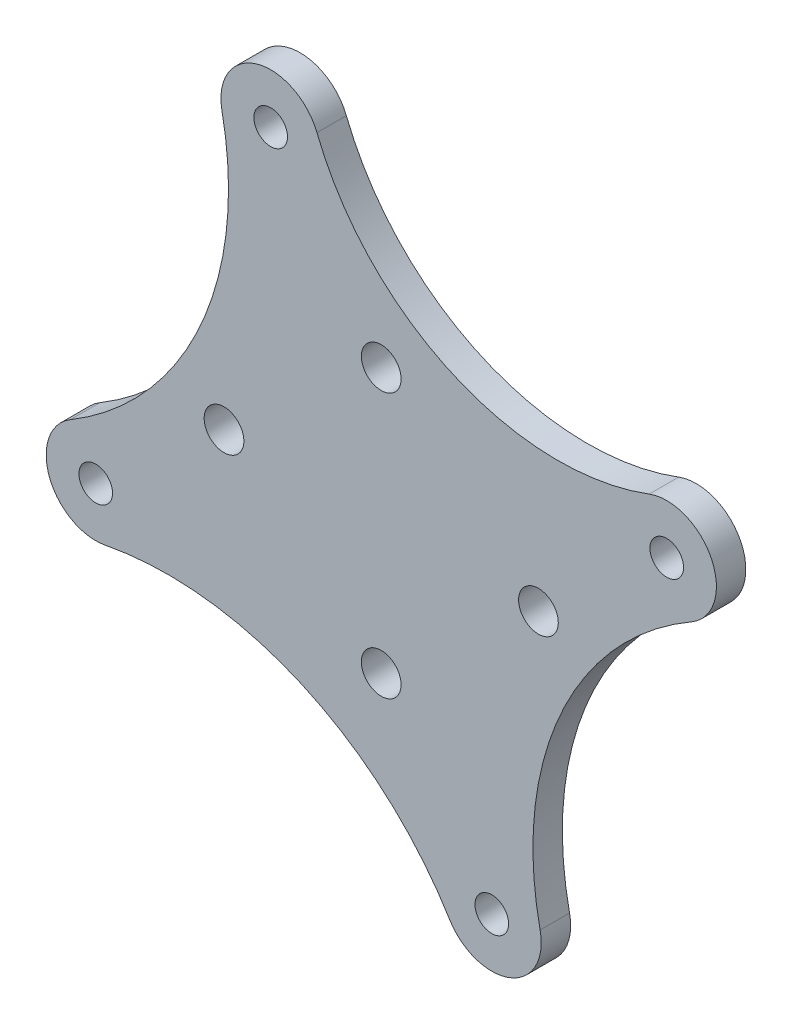
from build123d import *

# Parameters (mm, degrees)
SKETCH1_R           = 1.2
SKETCH1_R_2         = 1.016
BOSS_EXTRUDE1_DEPTH = 1.778


with BuildPart() as part:
    # Sketch1 → Boss-Extrude1 (new body)
    with BuildSketch(Plane.XY):
        with BuildLine():
            ThreePointArc((-18.786436302, -4.117817235), (-20.050708925, -7.759998805), (-16.680479475, -9.632276912))
            ThreePointArc((-16.680479475, -9.632276912), (-4.834628254, -10.963744593), (4.131590393, -18.818928901))
            ThreePointArc((4.131590393, -18.818928901), (7.793176957, -20.037700838), (9.603735314, -16.629695609))
            ThreePointArc((9.603735314, -16.629695609), (10.808475978, -4.78617574), (18.757897672, 4.075373655))
            ThreePointArc((18.757897672, 4.075373655), (19.966132816, 7.95635676), (16.197476331, 9.479212735))
            ThreePointArc((16.197476331, 9.479212735), (4.341589411, 9.810476534), (-3.884701894, 18.354475699))
            ThreePointArc((-3.884701894, 18.354475699), (-7.540001964, 20.125778306), (-9.626354431, 16.640686499))
            ThreePointArc((-9.626354431, 16.640686499), (-10.896236616, 4.800764559), (-18.786436302, -4.117817235))
        make_face()
        with Locations((0, 8)):
            Circle(SKETCH1_R, mode=Mode.SUBTRACT)
        with Locations((-9.5, 0)):
            Circle(SKETCH1_R, mode=Mode.SUBTRACT)
        with Locations((9.5, 0)):
            Circle(SKETCH1_R, mode=Mode.SUBTRACT)
        with Locations((0, -8)):
            Circle(SKETCH1_R, mode=Mode.SUBTRACT)
        with Locations((17.255056752, 6.671807588)):
            Circle(SKETCH1_R_2, mode=Mode.SUBTRACT)
        with Locations((6.683111778, -17.263013667)):
            Circle(SKETCH1_R_2, mode=Mode.SUBTRACT)
        with Locations((-17.251709477, -6.691068694)):
            Circle(SKETCH1_R_2, mode=Mode.SUBTRACT)
        with Locations((-6.679764504, 17.243752562)):
            Circle(SKETCH1_R_2, mode=Mode.SUBTRACT)
    extrude(amount=BOSS_EXTRUDE1_DEPTH)


solid = part.part
